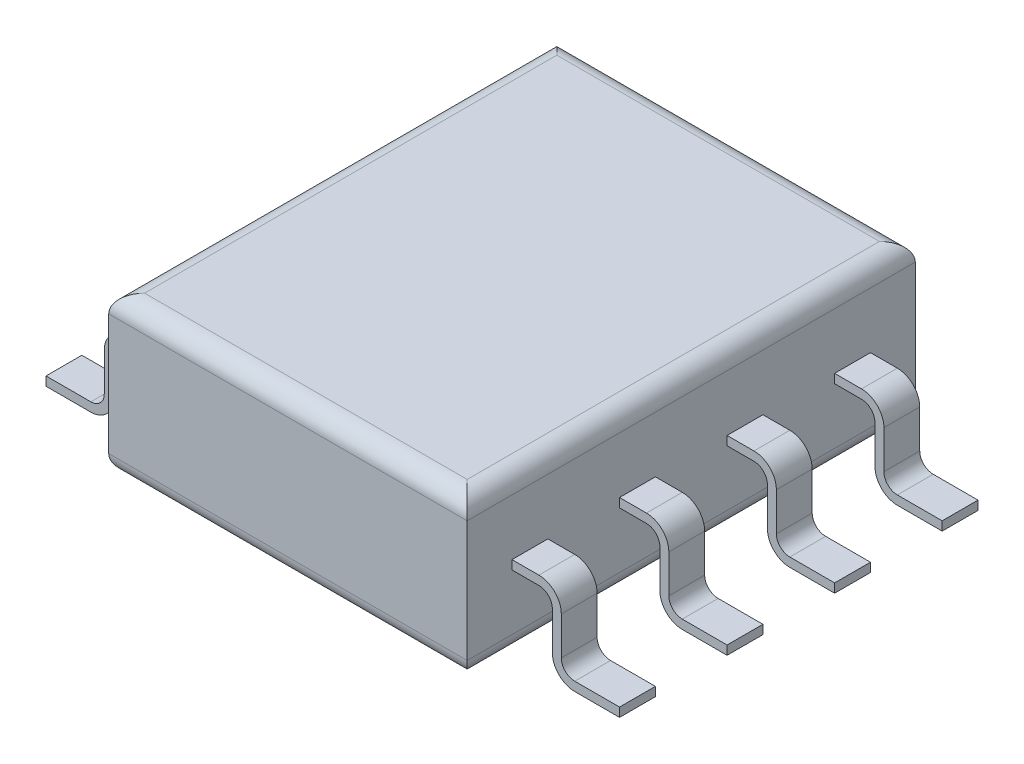
from build123d import *

# Parameters (mm, degrees)
SKETCH1_W               = 4
SKETCH1_H               = 5
BOSS_EXTRUDE1_DEPTH     = 1.75
FILLET1_R               = 0.2
SKETCH3_W               = 0.4
SKETCH3_H               = 0.1
LPATTERN1_COUNT         = 4
LPATTERN1_PITCH         = 1.2
MIRROR1_COPY_1_SKETCH_W = 0.4
MIRROR1_COPY_1_SKETCH_H = 0.1
MIRROR1_COPY_2_SKETCH_W = 0.4
MIRROR1_COPY_2_SKETCH_H = 0.1
MIRROR1_COPY_3_SKETCH_W = 0.4
MIRROR1_COPY_3_SKETCH_H = 0.1


with BuildPart() as part:
    # Sketch1 → Boss-Extrude1 (new body)
    with BuildSketch(Plane(origin=(0, 0, 0), x_dir=(1, 0, 0), z_dir=(0, 1, 0))):
        Rectangle(SKETCH1_W, SKETCH1_H)
    extrude(amount=BOSS_EXTRUDE1_DEPTH)

    # Fillet1
    fillet1_edges = [part.edges().sort_by_distance(p)[0] for p in [
        (-2, 1.75, 0),
        (0, 1.75, 2.5),
        (2, 1.75, 0),
        (0, 0, 2.5),
        (-2, 0, 0),
        (0, 0, -2.5),
        (2, 0, 0),
        (0, 1.75, -2.5),
    ]]
    fillet(fillet1_edges, radius=FILLET1_R)

    # Sweep1: sweep along a path in Sketch2
    with BuildLine(Plane(origin=(0, 0, -1.8), x_dir=(-1, 0, 0), z_dir=(0, 0, -1))) as sweep1_path:
        Line((2, 0.875), (2.3, 0.875))
        ThreePointArc((2.3, 0.875), (2.441421356, 0.816421356), (2.5, 0.675))
        Line((2.5, 0.675), (2.5, 0.25))
        ThreePointArc((2.5, 0.25), (2.558578644, 0.108578644), (2.7, 0.05))
        Line((2.7, 0.05), (3.2, 0.05))
    # Sketch3 → Sweep1 (sweep)
    with BuildSketch(Plane.ZY.offset(2)):
        with Locations((-1.8, 0.875)):
            Rectangle(SKETCH3_W, SKETCH3_H)
    sweep1 = sweep(path=sweep1_path.line)

    # LPattern1: Sweep1 ×4
    with Locations(*[(0, 0, i * LPATTERN1_PITCH) for i in range(1, LPATTERN1_COUNT)]):
        add(sweep1)

    # Mirror1: Sweep1 across plane
    add(sweep1.mirror(Plane(origin=(0, 0, 0), x_dir=(0, 0, 1), z_dir=(1, 0, 0))))

    # Mirror1 copy 1: sweep along a path in Mirror1 copy 1 path
    with BuildLine(Plane(origin=(0, 0, -0.6), x_dir=(1, 0, 0), z_dir=(0, 0, -1))) as mirror1_copy_1_path:
        Line((2, -0.875), (2.3, -0.875))
        ThreePointArc((2.3, -0.875), (2.441421356, -0.816421356), (2.5, -0.675))
        Line((2.5, -0.675), (2.5, -0.25))
        ThreePointArc((2.5, -0.25), (2.558578644, -0.108578644), (2.7, -0.05))
        Line((2.7, -0.05), (3.2, -0.05))
    # Mirror1 copy 1 sketch → Mirror1 copy 1 (sweep)
    with BuildSketch(Plane(origin=(2, 0, 1.2), x_dir=(0, 0, 1), z_dir=(1, 0, 0))):
        with Locations((-1.8, -0.875)):
            Rectangle(MIRROR1_COPY_1_SKETCH_W, MIRROR1_COPY_1_SKETCH_H)
    sweep(path=mirror1_copy_1_path.line)

    # Mirror1 copy 2: sweep along a path in Mirror1 copy 2 path
    with BuildLine(Plane(origin=(0, 0, 0.6), x_dir=(1, 0, 0), z_dir=(0, 0, -1))) as mirror1_copy_2_path:
        Line((2, -0.875), (2.3, -0.875))
        ThreePointArc((2.3, -0.875), (2.441421356, -0.816421356), (2.5, -0.675))
        Line((2.5, -0.675), (2.5, -0.25))
        ThreePointArc((2.5, -0.25), (2.558578644, -0.108578644), (2.7, -0.05))
        Line((2.7, -0.05), (3.2, -0.05))
    # Mirror1 copy 2 sketch → Mirror1 copy 2 (sweep)
    with BuildSketch(Plane(origin=(2, 0, 2.4), x_dir=(0, 0, 1), z_dir=(1, 0, 0))):
        with Locations((-1.8, -0.875)):
            Rectangle(MIRROR1_COPY_2_SKETCH_W, MIRROR1_COPY_2_SKETCH_H)
    sweep(path=mirror1_copy_2_path.line)

    # Mirror1 copy 3: sweep along a path in Mirror1 copy 3 path
    with BuildLine(Plane(origin=(0, 0, 1.8), x_dir=(1, 0, 0), z_dir=(0, 0, -1))) as mirror1_copy_3_path:
        Line((2, -0.875), (2.3, -0.875))
        ThreePointArc((2.3, -0.875), (2.441421356, -0.816421356), (2.5, -0.675))
        Line((2.5, -0.675), (2.5, -0.25))
        ThreePointArc((2.5, -0.25), (2.558578644, -0.108578644), (2.7, -0.05))
        Line((2.7, -0.05), (3.2, -0.05))
    # Mirror1 copy 3 sketch → Mirror1 copy 3 (sweep)
    with BuildSketch(Plane(origin=(2, 0, 3.6), x_dir=(0, 0, 1), z_dir=(1, 0, 0))):
        with Locations((-1.8, -0.875)):
            Rectangle(MIRROR1_COPY_3_SKETCH_W, MIRROR1_COPY_3_SKETCH_H)
    sweep(path=mirror1_copy_3_path.line)


solid = part.part
